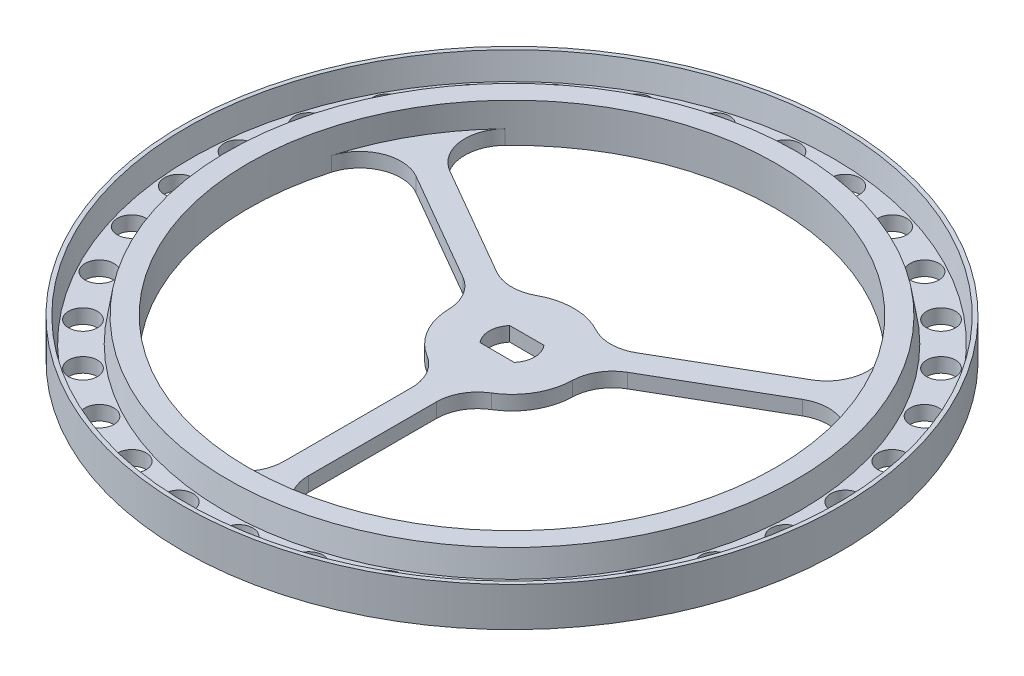
from build123d import *
from build123d.topology import SkipClean

# Parameters (mm, degrees)
SKETCH4_R                = 1.75
BOSS_EXTRUDE3_DEPTH      = 1.75
CIRPATTERN1_COUNT        = 32
SKETCH5_R                = 7.5
BOSS_EXTRUDE4_DEPTH      = 1.75
SKETCH7_W                = 3
SKETCH7_H                = 25.2
BOSS_EXTRUDE5_DEPTH      = 1.75
FILLET1_R                = 5
CIRPATTERN2_COUNT        = 3
FILLET1_OF_CIRPATTERN2_R = 5


with BuildPart() as part:
    # Sketch4 → Boss-Extrude3 (new body)
    with BuildSketch(Plane(origin=(0, 0, 0), x_dir=(1, 0, 0), z_dir=(0, 1, 0))):
        with BuildLine():
            Line((32, 0), (40, 0))
            ThreePointArc((40, 0), (39.807389067, 3.920685613), (39.231411216, 7.803612881))
            Line((39.231411216, 7.803612881), (31.385128973, 6.242890305))
            ThreePointArc((31.385128973, 6.242890305), (31.845911254, 3.136548491), (32, 0))
        make_face()
        with Locations(Location((36.821834887, 3.626634192, 0), (0, 0, 270))):
            Circle(SKETCH4_R, mode=Mode.SUBTRACT)
    boss_extrude3 = extrude(amount=BOSS_EXTRUDE3_DEPTH)

    # CirPattern1: Boss-Extrude3 ×32 about axis
    cirpattern1_axis = Axis((0, 0, 0), (0, 1, 0))
    for i in range(1, CIRPATTERN1_COUNT):
        add(boss_extrude3.rotate(cirpattern1_axis, i * 360 / CIRPATTERN1_COUNT))



with BuildPart() as body_2:
    # Sketch5 → Boss-Extrude4 (new body)
    with BuildSketch(Plane.XZ):
        with Locations(Location((0, 0, 0), (0, 0, 270))):
            Circle(SKETCH5_R)
        with BuildLine():
            Line((2.079062289, 1.8), (-2.079062289, 1.8))
            ThreePointArc((-2.079062289, 1.8), (-2.75, 0), (-2.079062289, -1.8))
            Line((-2.079062289, -1.8), (2.079062289, -1.8))
            ThreePointArc((2.079062289, -1.8), (2.75, 0), (2.079062289, 1.8))
        make_face(mode=Mode.SUBTRACT)
    extrude(amount=-BOSS_EXTRUDE4_DEPTH)


with BuildPart() as part_1:
    add(part.part)

    add(body_2.part)  # Boss-Extrude5 merges body 2
    # Sketch7 → Boss-Extrude5 (add)
    with BuildSketch(Plane.XZ):
        with Locations((0, 19.4)):
            Rectangle(SKETCH7_W, SKETCH7_H)
    boss_extrude5 = extrude(amount=-BOSS_EXTRUDE5_DEPTH)

    # Fillet1
    fillet1_edges = [part_1.edges().sort_by_distance(p)[0] for p in [
        (-1.5, 0.875, 7.348469228),
        (1.5, 0.875, 7.348469228),
        (-1.5, 0.875, 31.964824417),
        (1.5, 0.875, 31.964824417),
    ]]
    fillet(fillet1_edges, radius=FILLET1_R)

    # CirPattern2: Boss-Extrude5 ×3 about axis
    cirpattern2_axis = Axis((0, 0, 0), (0, 1, 0))
    for i in range(1, CIRPATTERN2_COUNT):
        add(boss_extrude5.rotate(cirpattern2_axis, i * 360 / CIRPATTERN2_COUNT))

    # Fillet1 of CirPattern2
    fillet1_of_cirpattern2_edges = [part_1.edges().sort_by_distance(p)[0] for p in [
        (7.113961031, 0.875, -2.375196508),
        (5.613961031, 0.875, -4.97327272),
        (28.432349972, 0.875, -14.683374103),
        (26.932349972, 0.875, -17.281450314),
        (-5.613961031, 0.875, -4.97327272),
        (-7.113961031, 0.875, -2.375196508),
        (-26.932349972, 0.875, -17.281450314),
        (-28.432349972, 0.875, -14.683374103),
    ]]
    fillet(fillet1_of_cirpattern2_edges, radius=FILLET1_OF_CIRPATTERN2_R)

    # Sketch8 → Revolve1 (revolve)
    with SkipClean():  # the faces are left unmerged after this step: merging them gives an invalid solid
        with BuildSketch(Plane.XY, mode=Mode.PRIVATE) as revolve1_sk:
            Polygon((-40, 1.75), (-40, 4.75), (-39.5, 4.75), (-39, 1.75), align=None)
            Polygon((-32, 1.75), (-32, 4.75), (-34.5, 4.75), (-35, 1.75), align=None)
        revolve(revolve1_sk.sketch.rotate(Axis((0, 0, 0), (0, 1, 0)), 270), axis=Axis((0, 0, 0), (0, 1, 0)))


solid = part_1.part
